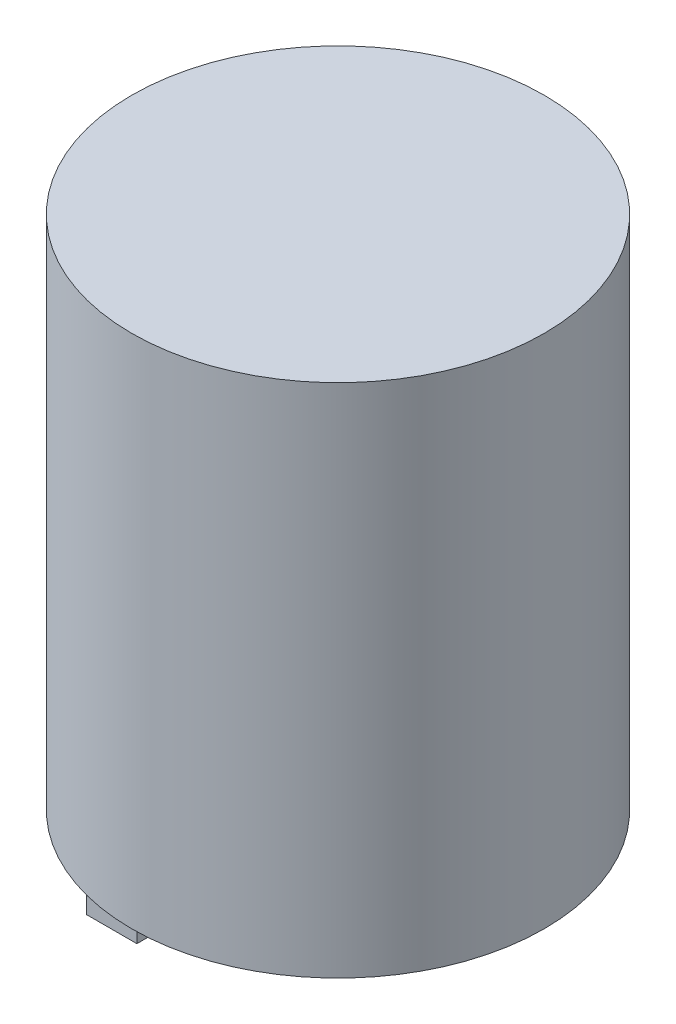
from build123d import *

# Parameters (mm, degrees)
SKETCH1_R           = 10
BOSS_EXTRUDE1_DEPTH = 25
SKETCH2_W           = 1.25
SKETCH2_H           = 5
BOSS_EXTRUDE2_DEPTH = 8
BOSS_EXTRUDE3_DEPTH = 1.2


with BuildPart() as part:
    # Sketch1 → Boss-Extrude1 (new body)
    with BuildSketch(Plane(origin=(0, 0, 0), x_dir=(1, 0, 0), z_dir=(0, 1, 0))):
        with Locations(Location((0, 0, 0), (0, 0, 270))):
            Circle(SKETCH1_R)
    extrude(amount=BOSS_EXTRUDE1_DEPTH)


with BuildPart() as body_2:
    # Sketch2 → Boss-Extrude2 (new body)
    with BuildSketch(Plane(origin=(0, 0, 0), x_dir=(-1, 0, 0), z_dir=(0, -1, 0))):
        with Locations((7.875, 0)):
            Rectangle(SKETCH2_W, SKETCH2_H)
    extrude(amount=BOSS_EXTRUDE2_DEPTH)

    # Sketch3 → Boss-Extrude3 (add)
    with BuildSketch(Plane.ZY.offset(8.5)):
        Polygon((-2.5, -8), (-2.5, 0), (2.5, 0), (2.5, -8), (1.5, -8), (1.5, -0.75), (-1.5, -0.75), (-1.5, -8), align=None)
    extrude(amount=BOSS_EXTRUDE3_DEPTH)


solid = Compound([part.part, body_2.part])
